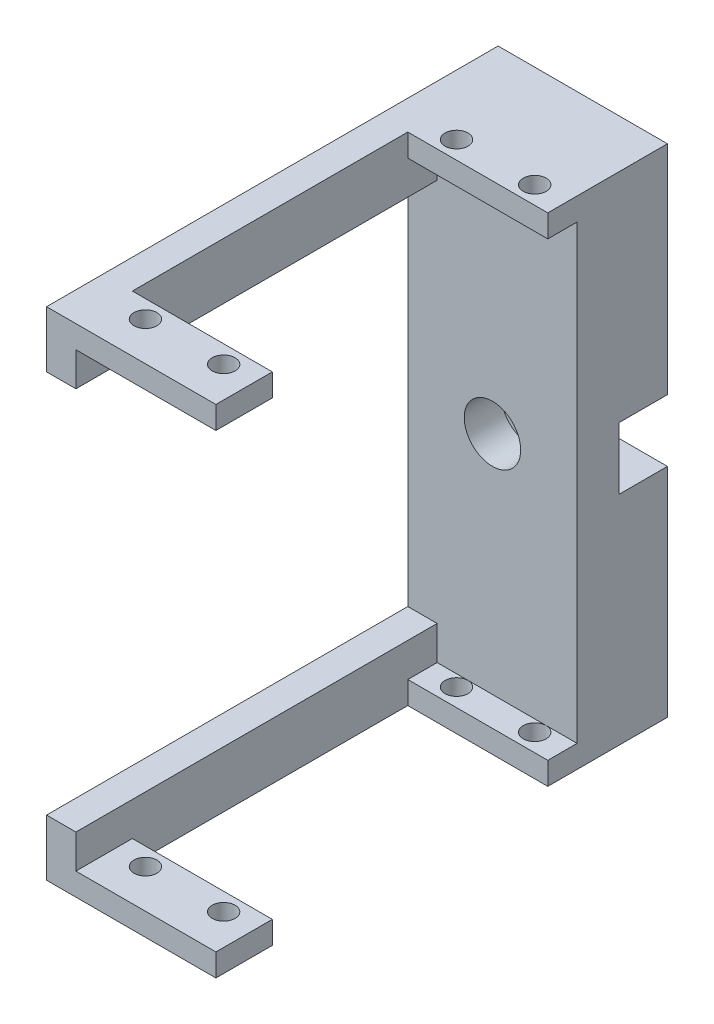
from build123d import *

# Parameters (mm, degrees)
SKETCH1_W          = 15
SKETCH1_H          = 44
EXTRUDE1_DEPTH     = 40
SKETCH2_W          = 15
SKETCH2_H          = 34
CUT_EXTRUDE1_DEPTH = 32
CUT_EXTRUDE2_DEPTH = 4.3
SKETCH4_R          = 1.25
CUT_EXTRUDE3_DEPTH = 4.3
SKETCH5_R          = 2.5
CUT_EXTRUDE4_DEPTH = 3.3
SKETCH6_W          = 12.4
SKETCH6_H          = 24.4
CUT_EXTRUDE5_DEPTH = 10
SKETCH7_W          = 5
SKETCH7_H          = 3
SKETCH7_W_2        = 2.6
CUT_EXTRUDE6_DEPTH = 12.4
SKETCH8_R          = 1.016
CUT_EXTRUDE7_DEPTH = 20


with BuildPart() as part:
    # Sketch1 → Extrude1 (new body)
    with BuildSketch(Plane.XY):
        with Locations((-19.74138299, 12.778040673)):
            Rectangle(SKETCH1_W, SKETCH1_H)
    extrude(amount=EXTRUDE1_DEPTH)

    # Sketch2 → Cut-Extrude1 (cut)
    with BuildSketch(Plane.XY.offset(40)):
        with Locations((-19.74138299, 12.778040673)):
            Rectangle(SKETCH2_W, SKETCH2_H)
    extrude(amount=-CUT_EXTRUDE1_DEPTH, mode=Mode.SUBTRACT)

    # Sketch3 → Cut-Extrude2 (cut)
    with BuildSketch(Plane(origin=(0, 0, 0), x_dir=(-1, 0, 0), z_dir=(0, 0, -1))):
        Polygon((22.49138299, 10.028040673), (27.24138299, 10.028040673), (27.24138299, 15.528040673), (22.49138299, 15.528040673), (22.49138299, 27.528040673), (16.99138299, 27.528040673), (16.99138299, 15.528040673), (12.24138299, 15.528040673), (12.24138299, 10.028040673), (16.99138299, 10.028040673), (16.99138299, -1.971959327), (22.49138299, -1.971959327), align=None)
    extrude(amount=-CUT_EXTRUDE2_DEPTH, mode=Mode.SUBTRACT)

    # Sketch4 → Cut-Extrude3 (cut)
    with BuildSketch(Plane(origin=(0, 0, 4.3), x_dir=(-1, 0, 0), z_dir=(0, 0, -1))):
        with Locations((19.74138299, 12.778040673)):
            Circle(SKETCH4_R)
    extrude(amount=-CUT_EXTRUDE3_DEPTH, mode=Mode.SUBTRACT)

    # Sketch5 → Cut-Extrude4 (cut)
    with BuildSketch(Plane.XY.offset(8)):
        with Locations((-19.74138299, 12.778040673)):
            Circle(SKETCH5_R)
    extrude(amount=-CUT_EXTRUDE4_DEPTH, mode=Mode.SUBTRACT)

    # Sketch6 → Cut-Extrude5 (cut)
    with BuildSketch(Plane(origin=(0, -4.221959327, 0), x_dir=(1, 0, 0), z_dir=(0, 1, 0))):
        with Locations((-18.44138299, -22.8)):
            Rectangle(SKETCH6_W, SKETCH6_H)
    cut_extrude5 = extrude(amount=-CUT_EXTRUDE5_DEPTH, mode=Mode.SUBTRACT)

    # Sketch7 → Cut-Extrude6 (cut)
    with BuildSketch(Plane(origin=(-12.24138299, 0, 0), x_dir=(0, 0, -1), z_dir=(1, 0, 0))):
        with Locations((-37.5, -5.721959327)):
            Rectangle(SKETCH7_W, SKETCH7_H)
        with Locations((-9.3, -5.721959327)):
            Rectangle(SKETCH7_W_2, SKETCH7_H)
    cut_extrude6 = extrude(amount=-CUT_EXTRUDE6_DEPTH, mode=Mode.SUBTRACT)

    # Sketch8 → Cut-Extrude7 (cut)
    with BuildSketch(Plane.XZ.offset(9.221959327)):
        with Locations((-21.90518052, 36.578)):
            Circle(SKETCH8_R)
        with Locations(Location((-14.977585459, 36.578, 0), (0, 0, 270))):
            Circle(SKETCH8_R)
        with Locations((-14.977585459, 9.022)):
            Circle(SKETCH8_R)
        with Locations(Location((-21.90518052, 9.022, 0), (0, 0, 270))):
            Circle(SKETCH8_R)
    cut_extrude7 = extrude(amount=-CUT_EXTRUDE7_DEPTH, mode=Mode.SUBTRACT)

    # Mirror1: Cut-Extrude5, Cut-Extrude6, Cut-Extrude7 across plane
    add(cut_extrude5.mirror(Plane(origin=(0, 12.778040673, 0), x_dir=(0, 0, 1), z_dir=(0, -1, 0))), mode=Mode.SUBTRACT)
    add(cut_extrude6.mirror(Plane(origin=(0, 12.778040673, 0), x_dir=(0, 0, 1), z_dir=(0, -1, 0))), mode=Mode.SUBTRACT)
    add(cut_extrude7.mirror(Plane(origin=(0, 12.778040673, 0), x_dir=(0, 0, 1), z_dir=(0, -1, 0))), mode=Mode.SUBTRACT)


solid = part.part
